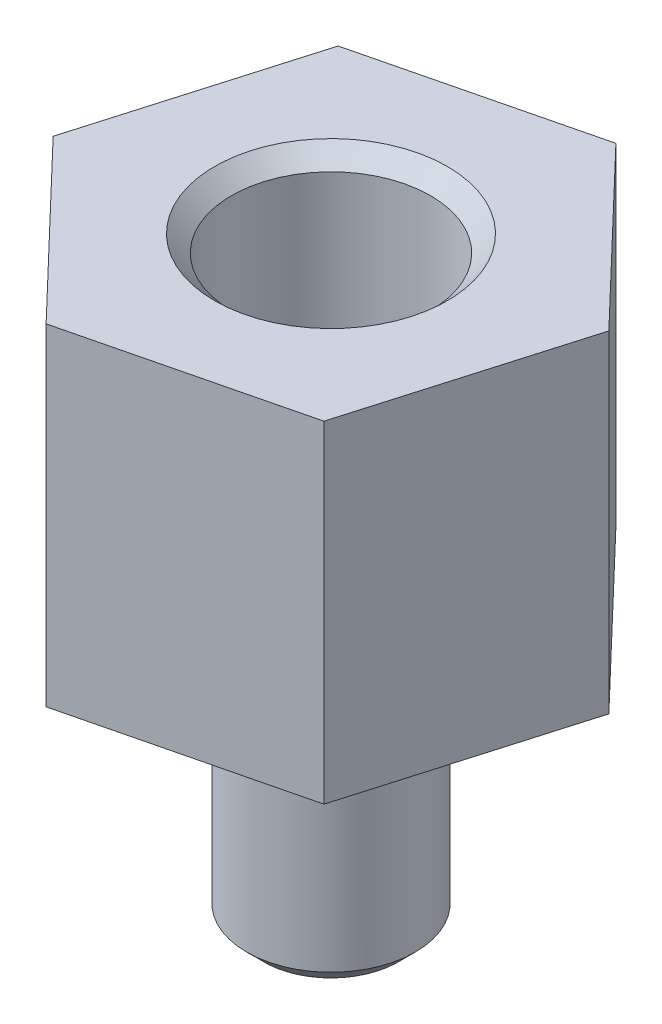
from build123d import *

# Parameters (mm, degrees)
BOSS_EXTRUDE1_DEPTH = 5
SKETCH2_R           = 1.5
CUT_EXTRUDE1_DEPTH  = 4
SKETCH3_R           = 1.27
BOSS_EXTRUDE2_DEPTH = 4
CHAMFER1_SIZE       = 0.254
CHAMFER2_SIZE       = 0.254


with BuildPart() as part:
    # Sketch1 → Boss-Extrude1 (new body)
    with BuildSketch(Plane(origin=(0, 0, 0), x_dir=(1, 0, 0), z_dir=(0, 1, 0))):
        Polygon((2.395673947, -2.502148345), (3.364761004, 0.823640325), (0.969087057, 3.32578867), (-2.395673947, 2.502148345), (-3.364761004, -0.823640325), (-0.969087057, -3.32578867), align=None)
    extrude(amount=BOSS_EXTRUDE1_DEPTH)

    # Sketch2 → Cut-Extrude1 (cut)
    with BuildSketch(Plane(origin=(0, 5, 0), x_dir=(1, 0, 0), z_dir=(0, 1, 0))):
        with Locations(Location((0, 0, 0), (0, 0, 270))):
            Circle(SKETCH2_R)
    extrude(amount=-CUT_EXTRUDE1_DEPTH, mode=Mode.SUBTRACT)

    # Sketch3 → Boss-Extrude2 (add)
    with BuildSketch(Plane.XZ):
        with Locations(Location((0, 0, 0), (0, 0, 90))):
            Circle(SKETCH3_R)
    extrude(amount=BOSS_EXTRUDE2_DEPTH)

    # Chamfer1
    chamfer1_edges = [part.edges().sort_by_distance(p)[0] for p in [
        (0, -4, -1.27),
    ]]
    chamfer(chamfer1_edges, length=CHAMFER1_SIZE)

    # Chamfer2
    chamfer2_edges = [part.edges().sort_by_distance(p)[0] for p in [
        (0, 5, -1.5),
    ]]
    chamfer(chamfer2_edges, length=CHAMFER2_SIZE)


solid = part.part
